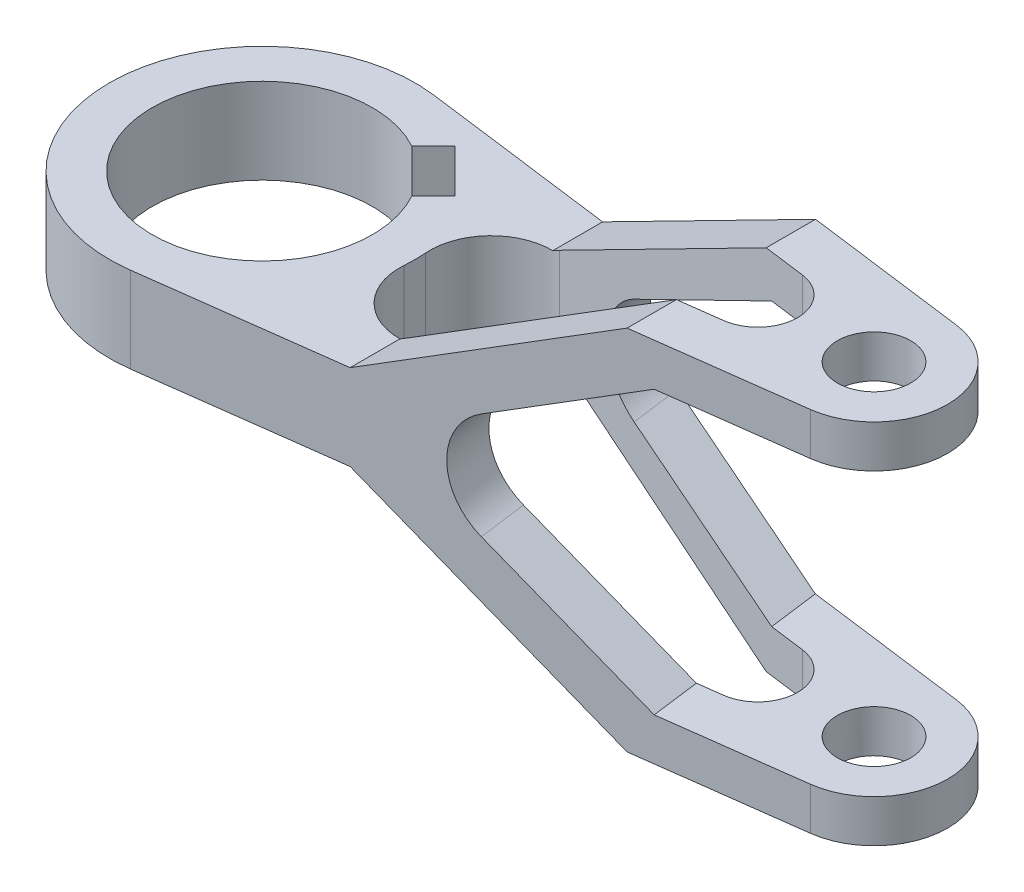
from build123d import *

# Parameters (mm, degrees)
BOSS_EXTRUDE2_DEPTH            = 30
BOSS_EXTRUDE2_DEPTH_BACK       = 30
SKETCH1_R                      = 6
SKETCH1_R_2                    = 18
CUT_EXTRUDE1_DEPTH             = 30
CUT_EXTRUDE1_DIRECTION_2_REACH = 120.648
CUT_EXTRUDE3_DEPTH             = 124.351468544
FILLET1_R                      = 10
CUT_EXTRUDE4_DEPTH             = 121.608033182


with BuildPart() as part:
    # Sketch1 → Boss-Extrude2 (new, two sides: drawn at the far end of the back side and taken through both)
    with BuildSketch(Plane(origin=(0, 0, 0), x_dir=(1, 0, 0), z_dir=(0, 1, 0)).offset(-BOSS_EXTRUDE2_DEPTH_BACK)):
        with BuildLine():
            Line((3.240740741, 24.789062093), (101.560356653, 11.935474341))
            ThreePointArc((101.560356653, 11.935474341), (112.037037037, 0), (101.560356653, -11.935474341))
            Line((101.560356653, -11.935474341), (3.240740741, -24.789062093))
            ThreePointArc((3.240740741, -24.789062093), (-25, 0), (3.240740741, 24.789062093))
        make_face()
        with Locations((100, 0)):
            Circle(SKETCH1_R, mode=Mode.SUBTRACT)
        Circle(SKETCH1_R_2, mode=Mode.SUBTRACT)
        with BuildLine():
            Line((20.379344255, 14.480411863), (81.842592593, 6.445156144))
            ThreePointArc((81.842592593, 6.445156144), (87.5, 0), (81.842592593, -6.445156144))
            Line((81.842592593, -6.445156144), (20.379344255, -14.480411863))
            ThreePointArc((20.379344255, -14.480411863), (25, 0), (20.379344255, 14.480411863))
        make_face(mode=Mode.SUBTRACT)
    extrude(amount=BOSS_EXTRUDE2_DEPTH + BOSS_EXTRUDE2_DEPTH_BACK)

    # Sketch3 → Cut-Extrude1 (cut)
    with BuildSketch(Plane.XY):
        Polygon((-25, 7), (35, 7), (75.037037037, 30), (-25, 30), align=None)
    cut_extrude1 = extrude(amount=-CUT_EXTRUDE1_DEPTH, mode=Mode.SUBTRACT)

    # Sketch3 → Cut-Extrude1 direction 2 (cut, up to next)
    with BuildSketch(Plane.XY, mode=Mode.PRIVATE) as cut_extrude1_direction_2_sk1:
        Polygon((-25, 7), (35, 7), (75.037037037, 30), (-25, 30), align=None)
    cut_extrude1_direction_2_tool1 = extrude(cut_extrude1_direction_2_sk1.sketch, amount=CUT_EXTRUDE1_DIRECTION_2_REACH, mode=Mode.PRIVATE) & part.part
    cut_extrude1_direction_2 = cut_extrude1_direction_2_tool1.solids().sort_by_distance((15.843943, 19.458999, 0))[0]
    add(cut_extrude1_direction_2, mode=Mode.SUBTRACT)

    # Mirror1: Cut-Extrude1, Cut-Extrude1 direction 2 across plane
    add(cut_extrude1.mirror(Plane.ZX), mode=Mode.SUBTRACT)
    add(cut_extrude1_direction_2.mirror(Plane.ZX), mode=Mode.SUBTRACT)

    # Sketch4 → Cut-Extrude3 (cut, through all)
    with BuildSketch(Plane(origin=(3.240740741, 0, 24.789062093), x_dir=(0.9915624837205597, 0, -0.12962962962962948), z_dir=(0.12962962962962948, 0, 0.9915624837205597))):
        with BuildLine():
            Line((51.158073352, 8.689189147), (76.366869206, 23.048648682))
            Line((76.366869206, 23.048648682), (111.193285409, 23.048648682))
            Line((111.193285409, 23.048648682), (111.193285409, -23.048648682))
            Line((111.193285409, -23.048648682), (76.366869206, -23.048648682))
            Line((76.366869206, -23.048648682), (51.158073352, -8.689189147))
            ThreePointArc((51.158073352, -8.689189147), (46.107617974, 0), (51.158073352, 8.689189147))
        make_face()
    extrude(amount=-CUT_EXTRUDE3_DEPTH, mode=Mode.SUBTRACT)

    # Fillet1
    fillet1_edges = [part.edges().sort_by_distance(p)[0] for p in [
        (20.379344255, 0, -14.480411863),
        (20.379344255, 0, 14.480411863),
    ]]
    fillet(fillet1_edges, radius=FILLET1_R)

    # Sketch5 → Cut-Extrude4 (cut, through all)
    with BuildSketch(Plane(origin=(0, 7, 0), x_dir=(1, 0, 0), z_dir=(0, 1, 0))):
        with BuildLine():
            Line((8.691485355, 15.762553167), (12.227019261, 19.298087073))
            Line((12.227019261, 19.298087073), (19.298087073, 12.227019261))
            Line((19.298087073, 12.227019261), (15.762553167, 8.691485355))
            ThreePointArc((15.762553167, 8.691485355), (-12.727922061, -12.727922061), (8.691485355, 15.762553167))
        make_face()
    extrude(amount=-CUT_EXTRUDE4_DEPTH, mode=Mode.SUBTRACT)


solid = part.part
